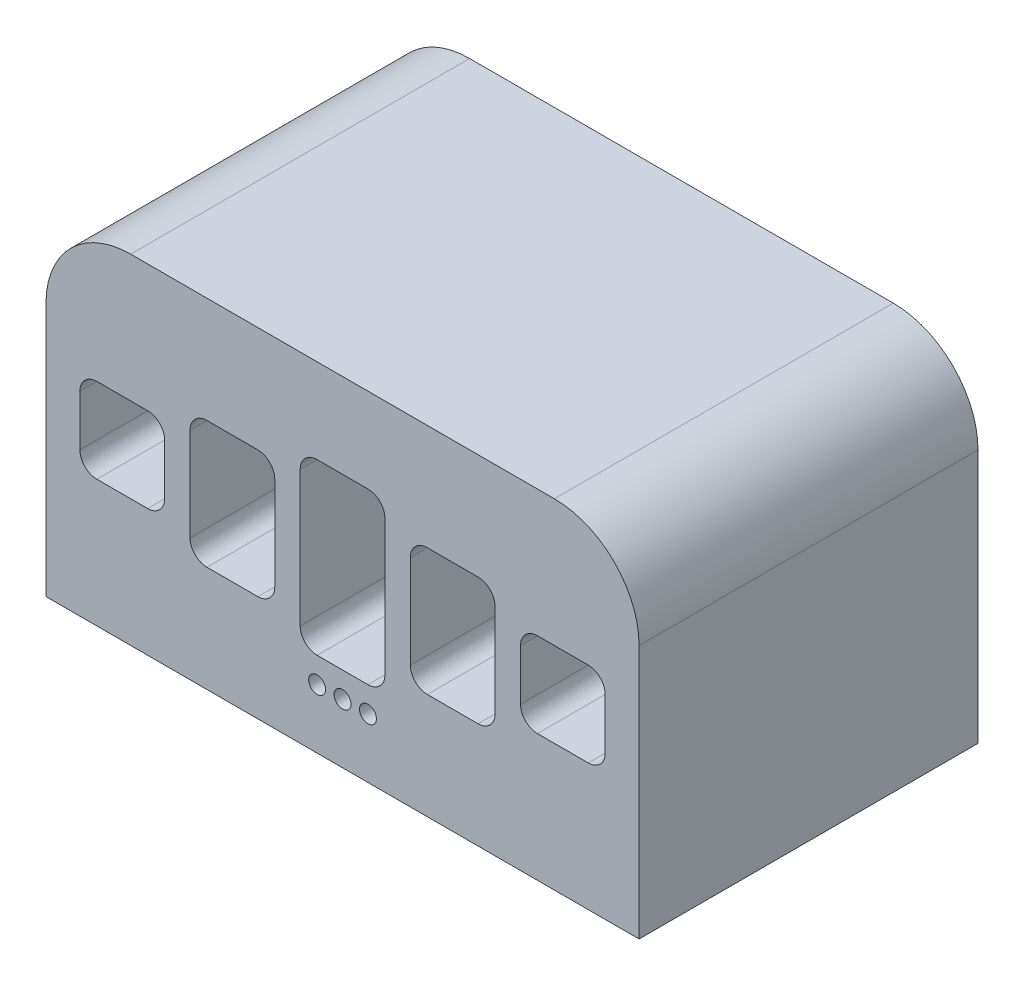
from build123d import *

# Parameters (mm, degrees)
SKETCH1_W           = 70
SKETCH1_H           = 40
BOSS_EXTRUDE1_DEPTH = 40
CUT_EXTRUDE1_DEPTH  = 10
CUT_EXTRUDE2_DEPTH  = 10
CUT_EXTRUDE3_DEPTH  = 10
SKETCH5_W           = 10
SKETCH5_H           = 10
CUT_EXTRUDE4_DEPTH  = 10
SKETCH6_W           = 10
SKETCH6_H           = 10
CUT_EXTRUDE5_DEPTH  = 10
FILLET21_R          = 2
FILLET22_R          = 10
SKETCH7_R           = 1
CUT_EXTRUDE6_DEPTH  = 10


with BuildPart() as part:
    # Sketch1 → Boss-Extrude1 (new body)
    with BuildSketch(Plane.XY):
        with Locations((35, 20)):
            Rectangle(SKETCH1_W, SKETCH1_H)
    extrude(amount=BOSS_EXTRUDE1_DEPTH)

    # Sketch2 → Cut-Extrude1 (cut)
    with BuildSketch(Plane.XY.offset(40)):
        Polygon((30, 20), (30, 30), (40, 30), (40, 20), (40, 10), (30, 10), align=None)
    extrude(amount=-CUT_EXTRUDE1_DEPTH, mode=Mode.SUBTRACT)

    # Sketch3 → Cut-Extrude2 (cut)
    with BuildSketch(Plane.XY.offset(40)):
        Polygon((27, 12.5), (17, 12.5), (17, 27.5), (27, 27.5), (27, 15), align=None)
    extrude(amount=-CUT_EXTRUDE2_DEPTH, mode=Mode.SUBTRACT)

    # Sketch4 → Cut-Extrude3 (cut)
    with BuildSketch(Plane.XY.offset(40)):
        Polygon((43, 25), (43, 27.5), (53, 27.5), (53, 12.5), (43, 12.5), align=None)
    extrude(amount=-CUT_EXTRUDE3_DEPTH, mode=Mode.SUBTRACT)

    # Sketch5 → Cut-Extrude4 (cut)
    with BuildSketch(Plane.XY.offset(40)):
        with Locations((9, 20)):
            Rectangle(SKETCH5_W, SKETCH5_H)
    extrude(amount=-CUT_EXTRUDE4_DEPTH, mode=Mode.SUBTRACT)

    # Sketch6 → Cut-Extrude5 (cut)
    with BuildSketch(Plane.XY.offset(40)):
        with Locations((61, 20)):
            Rectangle(SKETCH6_W, SKETCH6_H)
    extrude(amount=-CUT_EXTRUDE5_DEPTH, mode=Mode.SUBTRACT)

    # Fillet21
    fillet21_edges = [part.edges().sort_by_distance(p)[0] for p in [
        (30, 30, 35),
        (40, 30, 35),
        (40, 10, 35),
        (30, 10, 35),
        (17, 27.5, 35),
        (27, 27.5, 35),
        (27, 12.5, 35),
        (17, 12.5, 35),
        (53, 27.5, 35),
        (53, 12.5, 35),
        (43, 12.5, 35),
        (43, 27.5, 35),
        (14, 25, 35),
        (14, 15, 35),
        (4, 15, 35),
        (4, 25, 35),
        (66, 25, 35),
        (66, 15, 35),
        (56, 15, 35),
        (56, 25, 35),
    ]]
    fillet(fillet21_edges, radius=FILLET21_R)

    # Fillet22
    fillet22_edges = [part.edges().sort_by_distance(p)[0] for p in [
        (0, 40, 20),
        (70, 40, 20),
    ]]
    fillet(fillet22_edges, radius=FILLET22_R)

    # Sketch7 → Cut-Extrude6 (cut)
    with BuildSketch(Plane.XY.offset(40)):
        with Locations((32, 7)):
            Circle(SKETCH7_R)
        with Locations((35, 7)):
            Circle(SKETCH7_R)
        with Locations((38, 7)):
            Circle(SKETCH7_R)
    extrude(amount=-CUT_EXTRUDE6_DEPTH, mode=Mode.SUBTRACT)


solid = part.part
